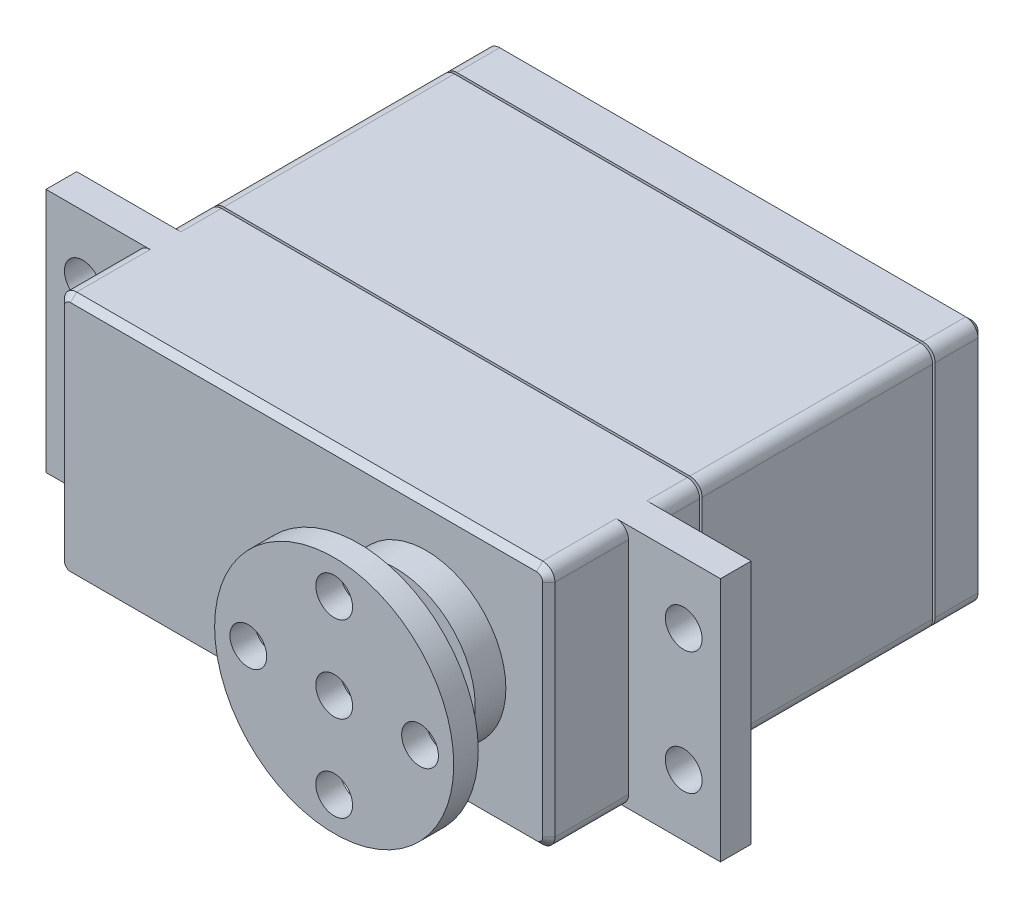
from build123d import *

# Parameters (mm, degrees)
SKETCH_1_W          = 40
SKETCH_1_H          = 20
EXTRUDE_1_DEPTH     = 35.5
SKETCH_2_R          = 6.5
EXTRUDE_2_DEPTH     = 2.5
SKETCH_3_R          = 4
EXTRUDE_3_DEPTH     = 3
SKETCH_4_R          = 9.75
SKETCH_4_R_2        = 1.5
EXTRUDE_4_DEPTH     = 2
SKETCH_5_W          = 7.5
SKETCH_5_H          = 20
SKETCH_5_R          = 1.5
EXTRUDE_5_DEPTH     = 2.5
FILLET_1_R          = 1
CHAMFER_1_SIZE      = 0.5
SKETCH_6_W          = 50.522526004
SKETCH_6_H          = 25.15959619
SKETCH_6_W_2        = 39
SKETCH_6_H_2        = 19
CUT_EXTRUDE_1_DEPTH = 0.2
SKETCH_7_W          = 45.47636499
SKETCH_7_H          = 25.202265372
SKETCH_7_W_2        = 39
SKETCH_7_H_2        = 19
CUT_EXTRUDE_2_DEPTH = 0.2
CUT_EXTRUDE_3_DEPTH = 0.2


with BuildPart() as part:
    # 草图1 → 凸台-拉伸1 (new body)
    with BuildSketch(Plane.XY):
        Rectangle(SKETCH_1_W, SKETCH_1_H)
    extrude(amount=EXTRUDE_1_DEPTH)

    # 草图2 → 凸台-拉伸2 (add)
    with BuildSketch(Plane.XY.offset(35.5)):
        with Locations((10, 0)):
            Circle(SKETCH_2_R)
    extrude(amount=EXTRUDE_2_DEPTH)

    # 草图3 → 凸台-拉伸3 (add)
    with BuildSketch(Plane.XY.offset(38)):
        with Locations((10, 0)):
            Circle(SKETCH_3_R)
    extrude(amount=EXTRUDE_3_DEPTH)

    # 草图4 → 凸台-拉伸4 (add)
    with BuildSketch(Plane.XY.offset(41)):
        with Locations((10, 0)):
            Circle(SKETCH_4_R)
        with Locations((10, 0)):
            Circle(SKETCH_4_R_2, mode=Mode.SUBTRACT)
        with Locations((10, 7)):
            Circle(SKETCH_4_R_2, mode=Mode.SUBTRACT)
        with Locations((17, 0)):
            Circle(SKETCH_4_R_2, mode=Mode.SUBTRACT)
        with Locations((10, -7)):
            Circle(SKETCH_4_R_2, mode=Mode.SUBTRACT)
        with Locations((3, 0)):
            Circle(SKETCH_4_R_2, mode=Mode.SUBTRACT)
    extrude(amount=EXTRUDE_4_DEPTH)

    # 草图5 → 凸台-拉伸5 (add)
    # profile 1 of 2: a face of its own
    with BuildSketch(Plane.XY.offset(29)):
        with Locations((-23.75, 0)):
            Rectangle(SKETCH_5_W, SKETCH_5_H)
        with Locations((-24.5, 5)):
            Circle(SKETCH_5_R, mode=Mode.SUBTRACT)
        with Locations((-24.5, -5)):
            Circle(SKETCH_5_R, mode=Mode.SUBTRACT)
    # profile 2 of 2: a face of its own
    with BuildSketch(Plane.XY.offset(29)):
        with Locations((23.75, 0)):
            Rectangle(SKETCH_5_W, SKETCH_5_H)
        with Locations(Location((24.5, -5, 0), (0, 0, 180))):
            Circle(SKETCH_5_R, mode=Mode.SUBTRACT)
        with Locations(Location((24.5, 5, 0), (0, 0, 180))):
            Circle(SKETCH_5_R, mode=Mode.SUBTRACT)
    extrude(amount=-EXTRUDE_5_DEPTH)

    # 圆角1
    fillet_1_edges = [part.edges().sort_by_distance(p)[0] for p in [
        (-20, -10, 13.25),
        (-20, 10, 13.25),
        (20, 10, 13.25),
        (20, -10, 13.25),
        (-20, 10, 32.25),
        (20, 10, 32.25),
        (20, -10, 32.25),
        (-20, -10, 32.25),
    ]]
    fillet(fillet_1_edges, radius=FILLET_1_R)

    # 倒角1
    chamfer_1_edges = [part.edges().sort_by_distance(p)[0] for p in [
        (0, 10, 0),
        (0, 10, 35.5),
        (-20, 0, 0),
        (20, 0, 0),
        (0, -10, 0),
        (-19.707106781, -9.707106781, 0),
        (-19.707106781, 9.707106781, 0),
        (19.707106781, -9.707106781, 0),
        (19.707106781, 9.707106781, 0),
        (20, 0, 35.5),
        (-20, 0, 35.5),
        (0, -10, 35.5),
        (-19.707106781, -9.707106781, 35.5),
        (-19.707106781, 9.707106781, 35.5),
        (19.707106781, -9.707106781, 35.5),
        (19.707106781, 9.707106781, 35.5),
    ]]
    chamfer(chamfer_1_edges, length=CHAMFER_1_SIZE)

    # 草图6 → 切除-拉伸1 (cut)
    with BuildSketch(Plane(origin=(0, 0, 4), x_dir=(-1, 0, 0), z_dir=(0, 0, -1))):
        Rectangle(SKETCH_6_W, SKETCH_6_H)
        Rectangle(SKETCH_6_W_2, SKETCH_6_H_2, mode=Mode.SUBTRACT)
    extrude(amount=-CUT_EXTRUDE_1_DEPTH, mode=Mode.SUBTRACT)

    # 草图7 → 切除-拉伸2 (cut)
    with BuildSketch(Plane(origin=(0, 0, 23), x_dir=(-1, 0, 0), z_dir=(0, 0, -1))):
        Rectangle(SKETCH_7_W, SKETCH_7_H)
        Rectangle(SKETCH_7_W_2, SKETCH_7_H_2, mode=Mode.SUBTRACT)
    extrude(amount=-CUT_EXTRUDE_2_DEPTH, mode=Mode.SUBTRACT)

    # 草图8 → 切除-拉伸3 (cut)
    with BuildSketch(Plane.XZ.offset(10)):
        Polygon((-6.6869143, 19.494480452), (-5.866027548, 19.494480452), (-5.866027548, 17.34548289), (-2.409907756, 19.494480452), (-1.201898274, 19.494480452), (-5.401946685, 16.882568059), (-0.828767933, 13.673647119), (-1.964483411, 13.673647119), (-5.866027548, 16.411491003), (-5.866027548, 13.673647119), (-6.6869143, 13.673647119), align=None)
        with BuildLine():
            Line((-1.149660027, 14.796536242), (-0.416225698, 15.091542418))
            add(Edge.make_bspline(
                [(-0.416225698, 15.091542418), (-0.353490833, 15.014510913), (-0.231710013, 14.864977479), (-0.031006212, 14.667264842), (0.17596295, 14.498433404), (0.391576352, 14.361031699), (0.614580033, 14.253535852), (0.844972942, 14.177395407), (1.082895983, 14.129867757), (1.244373415, 14.124241534), (1.325826585, 14.121403529)],
                knots=[0, 0, 0, 0, 1.152089572, 2.236434419, 3.262720936, 4.246162169, 5.196317325, 6.127660375, 7.055546052, 8, 8, 8, 8], degree=3))
            add(Edge.make_bspline(
                [(1.325826585, 14.121403529), (1.395486926, 14.122811961), (1.532962985, 14.12559153), (1.735362414, 14.152457336), (1.931451391, 14.193924765), (2.118185712, 14.253196953), (2.292115811, 14.324685106), (2.445587649, 14.4109342), (2.577375906, 14.508481667), (2.686331571, 14.616838084), (2.772207523, 14.733430138), (2.833336429, 14.85490771), (2.874150754, 14.979729753), (2.878150582, 15.065194806), (2.880147666, 15.107866871)],
                knots=[0, 0, 0, 0, 1.238349031, 2.443906286, 3.624874093, 4.798942716, 5.923617549, 6.963699705, 7.921824088, 8.83101724, 9.686901663, 10.484521922, 11.243333087, 12, 12, 12, 12], degree=3))
            add(Edge.make_bspline(
                [(2.880147666, 15.107866871), (2.876780402, 15.156568948), (2.869838171, 15.256977204), (2.810131878, 15.403260763), (2.718124694, 15.547517074), (2.635818006, 15.633559709), (2.592137683, 15.679222707)],
                knots=[0, 0, 0, 0, 0.887223272, 1.829173364, 2.84793798, 4, 4, 4, 4], degree=3))
            add(Edge.make_bspline(
                [(2.592137683, 15.679222707), (2.556037162, 15.712763998), (2.479186131, 15.784166924), (2.347631239, 15.886773942), (2.196541328, 15.995396142), (2.025658137, 16.10937162), (1.833272464, 16.22686436), (1.621252107, 16.35054495), (1.388144259, 16.478437478), (1.224938263, 16.56339302), (1.140427447, 16.607384432)],
                knots=[0, 0, 0, 0, 0.684072347, 1.456257804, 2.314658692, 3.268296586, 4.307941752, 5.444813601, 6.676881395, 8, 8, 8, 8], degree=3))
            add(Edge.make_bspline(
                [(1.140427447, 16.607384432), (1.05629783, 16.650975236), (0.89557048, 16.734254286), (0.668832744, 16.858310831), (0.465712584, 16.970732448), (0.288140349, 17.074086418), (0.136451051, 17.169325444), (0.007546501, 17.252038601), (-0.095524397, 17.326974963), (-0.152977665, 17.377016667), (-0.178355105, 17.399120376)],
                knots=[0, 0, 0, 0, 1.475543639, 2.818986114, 4.02480104, 5.09096343, 6.018093619, 6.813867338, 7.476078347, 8, 8, 8, 8], degree=3))
            add(Edge.make_bspline(
                [(-0.178355105, 17.399120376), (-0.213929234, 17.433143206), (-0.282975915, 17.499178932), (-0.374200485, 17.605224185), (-0.453768878, 17.712104353), (-0.515994692, 17.823203688), (-0.566573063, 17.935233292), (-0.601299354, 18.050065276), (-0.623230019, 18.167086535), (-0.625930276, 18.245954423), (-0.627277548, 18.285304938)],
                knots=[0, 0, 0, 0, 1.153424584, 2.23870947, 3.275830823, 4.271613903, 5.218145226, 6.15209119, 7.078000373, 8, 8, 8, 8], degree=3))
            add(Edge.make_bspline(
                [(-0.627277548, 18.285304938), (-0.626330908, 18.31644853), (-0.624453324, 18.378219331), (-0.610892932, 18.469862432), (-0.5905954, 18.559976984), (-0.559216906, 18.647191066), (-0.522717465, 18.733667392), (-0.473774797, 18.815667465), (-0.418847017, 18.897255548), (-0.332640779, 19.003374992), (-0.204124598, 19.127466505), (-0.024943062, 19.259914107), (0.18353303, 19.372507953), (0.415050744, 19.469675347), (0.666540827, 19.546060646), (0.930659187, 19.604270277), (1.20608968, 19.636535085), (1.392989408, 19.641308463), (1.487905078, 19.643732589)],
                knots=[0, 0, 0, 0, 0.539029401, 1.069121303, 1.601259569, 2.135436362, 2.671812815, 3.22354654, 3.785365854, 4.373914828, 5.587402901, 6.867381044, 8.219734826, 9.679516073, 11.207829841, 12.764024048, 14.356633122, 16, 16, 16, 16], degree=3))
            add(Edge.make_bspline(
                [(1.487905078, 19.643732589), (1.589089694, 19.641402267), (1.789145705, 19.636794897), (2.084012775, 19.596075684), (2.368450665, 19.529353586), (2.598535583, 19.45253676), (2.778671889, 19.374983478), (2.915801297, 19.305786325), (3.054284073, 19.224810379), (3.195815497, 19.133813567), (3.338744467, 19.031112879), (3.483793114, 18.917476145), (3.630491569, 18.79304648), (3.726634262, 18.703895968), (3.775660486, 18.65843528)],
                knots=[0, 0, 0, 0, 1.422078643, 2.811646575, 4.175598256, 5.525232754, 6.215510619, 6.931566771, 7.683268332, 8.469968427, 9.296431584, 10.156744404, 11.06006522, 12, 12, 12, 12], degree=3))
            Line((3.775660486, 18.65843528), (3.071376966, 18.300463358))
            add(Edge.make_bspline(
                [(3.071376966, 18.300463358), (3.029981447, 18.337221285), (2.949995493, 18.408246312), (2.830410441, 18.508016444), (2.715506718, 18.597759603), (2.604448537, 18.677228314), (2.498531106, 18.747053927), (2.397822794, 18.808487199), (2.301540608, 18.860148652), (2.178343042, 18.914028616), (2.024121333, 18.968945287), (1.832485783, 19.013815425), (1.63251732, 19.041367675), (1.496546044, 19.04491616), (1.427271397, 19.046724042)],
                knots=[0, 0, 0, 0, 1.074228015, 2.075663111, 3.021624324, 3.902793679, 4.724914158, 5.482914942, 6.191458127, 6.843165991, 8.090764799, 9.362211274, 10.656099381, 12, 12, 12, 12], degree=3))
            add(Edge.make_bspline(
                [(1.427271397, 19.046724042), (1.382950457, 19.04595341), (1.296540791, 19.044450957), (1.169490414, 19.035598723), (1.049233466, 19.017978388), (0.934897214, 18.994199037), (0.826332246, 18.96626155), (0.724739935, 18.927969063), (0.628466135, 18.885201445), (0.539507623, 18.835578807), (0.45945724, 18.780923653), (0.388528737, 18.723880625), (0.328601224, 18.662902328), (0.278761954, 18.598764099), (0.24137956, 18.53039471), (0.214003358, 18.459507054), (0.197189544, 18.385582891), (0.194806663, 18.335140297), (0.193609204, 18.309791617)],
                knots=[0, 0, 0, 0, 1.344780428, 2.621831248, 3.86091427, 5.028822096, 6.164433506, 7.257555437, 8.318398087, 9.358390499, 10.342883404, 11.256382275, 12.115274943, 12.931328421, 13.712469561, 14.47020682, 15.231240198, 16, 16, 16, 16], degree=3))
            add(Edge.make_bspline(
                [(0.193609204, 18.309791617), (0.194734612, 18.278525711), (0.197003211, 18.215499861), (0.222793424, 18.122941916), (0.258334026, 18.030371698), (0.31285224, 17.93919451), (0.38575486, 17.845688408), (0.484248651, 17.75252457), (0.605168493, 17.654052214), (0.696440698, 17.591224769), (0.745142491, 17.557700772)],
                knots=[0, 0, 0, 0, 0.76880994, 1.549768002, 2.354129864, 3.208810305, 4.157741603, 5.269146009, 6.542847899, 8, 8, 8, 8], degree=3))
            add(Edge.make_bspline(
                [(0.745142491, 17.557700772), (0.763731984, 17.546316004), (0.808142889, 17.519117421), (0.888227355, 17.474711545), (0.993433945, 17.42110192), (1.121409831, 17.352197988), (1.275152982, 17.275224992), (1.453044398, 17.185976305), (1.655494434, 17.086374201), (1.798476807, 17.015532672), (1.873861775, 16.978182709)],
                knots=[0, 0, 0, 0, 0.412210111, 0.984783423, 1.731088825, 2.645137316, 3.733213325, 4.982341228, 6.408991929, 8, 8, 8, 8], degree=3))
            add(Edge.make_bspline(
                [(1.873861775, 16.978182709), (1.964585521, 16.932246181), (2.139858597, 16.84349944), (2.390491063, 16.710155473), (2.618390234, 16.579511813), (2.823557917, 16.452472432), (3.007385295, 16.33045641), (3.168721883, 16.211658858), (3.308330927, 16.096640977), (3.426199115, 15.983418856), (3.526854663, 15.872822952), (3.612168538, 15.762320622), (3.686414511, 15.653251586), (3.746376462, 15.543197337), (3.792493871, 15.432561084), (3.824926906, 15.321880404), (3.846042384, 15.210883654), (3.848873492, 15.136720815), (3.850286555, 15.099704645)],
                knots=[0, 0, 0, 0, 1.709562351, 3.302776476, 4.772177714, 6.124901424, 7.359068972, 8.480380071, 9.491865779, 10.397660351, 11.22576364, 12.003453628, 12.742868209, 13.441670434, 14.106660575, 14.753818965, 15.378005873, 16, 16, 16, 16], degree=3))
            add(Edge.make_bspline(
                [(3.850286555, 15.099704645), (3.848503039, 15.04742298), (3.844950702, 14.943290414), (3.809031826, 14.79071996), (3.754027225, 14.643008895), (3.675719471, 14.500904269), (3.575778484, 14.363892119), (3.453262344, 14.232846024), (3.308351534, 14.108056193), (3.144504285, 13.989523513), (2.964778473, 13.880635805), (2.773401982, 13.784870201), (2.572437786, 13.704515069), (2.361892139, 13.638769751), (2.14194725, 13.588107531), (1.912608907, 13.550603718), (1.673763132, 13.527973422), (1.511275472, 13.525603298), (1.428437429, 13.524394982)],
                knots=[0, 0, 0, 0, 0.789167787, 1.571833384, 2.356547704, 3.16644455, 4.016223069, 4.914320835, 5.872282974, 6.903077527, 7.968268762, 9.045691288, 10.134668915, 11.236757733, 12.377033922, 13.543993062, 14.747899939, 16, 16, 16, 16], degree=3))
            add(Edge.make_bspline(
                [(1.428437429, 13.524394982), (1.364274732, 13.525231509), (1.237349574, 13.526886306), (1.049484065, 13.541857615), (0.86592422, 13.562896435), (0.687513434, 13.59640962), (0.513006146, 13.636942684), (0.343109546, 13.6867597), (0.177834847, 13.746859277), (0.016653495, 13.815312658), (-0.140960171, 13.895163837), (-0.294597091, 13.987494621), (-0.445782106, 14.091771658), (-0.593494612, 14.208521387), (-0.738673719, 14.33703064), (-0.879352565, 14.478574731), (-1.017792734, 14.6316864), (-1.105133738, 14.740873072), (-1.149660027, 14.796536242)],
                knots=[0, 0, 0, 0, 1.029753048, 2.037033552, 3.023718286, 3.994153229, 4.94908124, 5.898674701, 6.834164454, 7.770548408, 8.708074864, 9.667861764, 10.645669405, 11.654185788, 12.688370985, 13.756003842, 14.856014769, 16, 16, 16, 16], degree=3))
        make_face()
        Polygon((4.014463905, 18.897471905), (4.014463905, 19.494480452), (8.715906213, 19.494480452), (8.715906213, 18.897471905), (6.775628435, 18.897471905), (6.775628435, 13.673647119), (5.954741683, 13.673647119), (5.954741683, 18.897471905), align=None)
    extrude(amount=-CUT_EXTRUDE_3_DEPTH, mode=Mode.SUBTRACT)


solid = part.part
